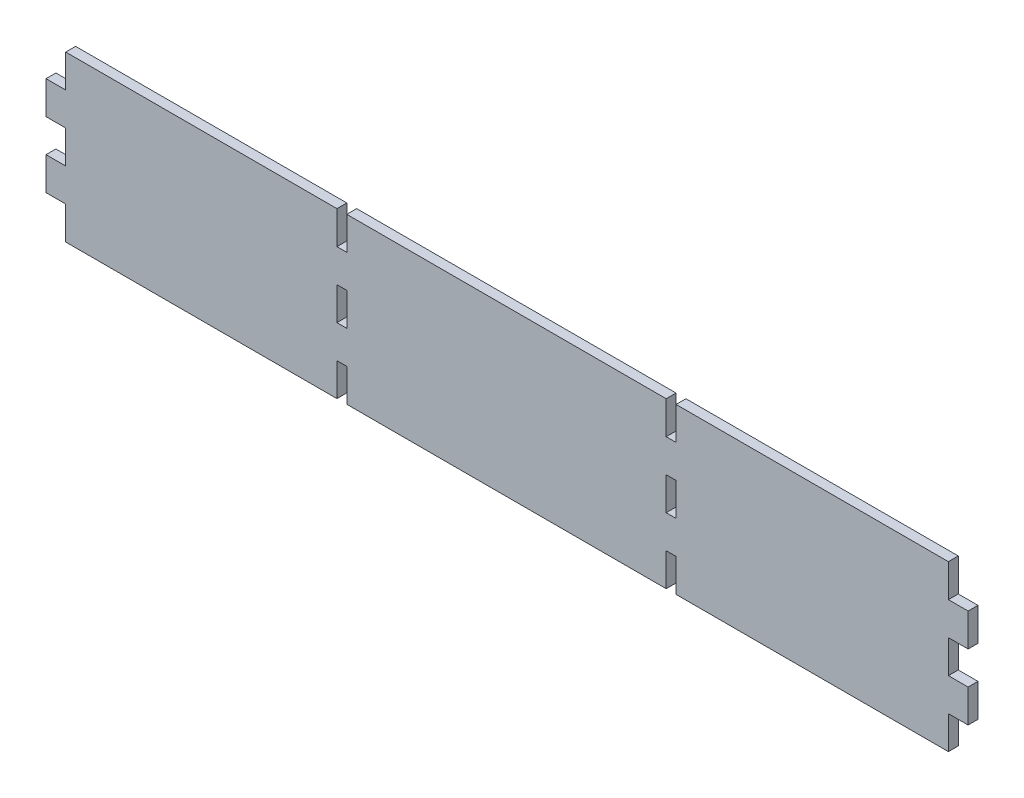
from build123d import *

# Parameters (mm, degrees)
SKETCH1_W           = 3
SKETCH1_H           = 10
BOSS_EXTRUDE1_DEPTH = 3


with BuildPart() as part:
    # Sketch1 → Boss-Extrude1 (new body)
    with BuildSketch(Plane.XY):
        Polygon((-85.4, 23.2), (-91.4, 23.2), (-91.4, 13.2), (-85.4, 13.2), (-85.4, 3.2), (-3, 3.2), (-3, 13.2), (0, 13.2), (0, 3.2), (97.05, 3.2), (97.05, 13.2), (100.05, 13.2), (100.05, 3.2), (182.8, 3.2), (182.8, 13.2), (188.8, 13.2), (188.8, 23.2), (182.8, 23.2), (182.8, 33.2), (188.8, 33.2), (188.8, 43.2), (182.8, 43.2), (182.8, 53.2), (100.05, 53.2), (100.05, 43.2), (97.05, 43.2), (97.05, 53.2), (0, 53.2), (0, 43.2), (-3, 43.2), (-3, 53.2), (-85.4, 53.2), (-85.4, 43.2), (-91.4, 43.2), (-91.4, 33.2), (-85.4, 33.2), align=None)
        with Locations((98.55, 28.2)):
            Rectangle(SKETCH1_W, SKETCH1_H, mode=Mode.SUBTRACT)
        with Locations((-1.5, 28.2)):
            Rectangle(SKETCH1_W, SKETCH1_H, mode=Mode.SUBTRACT)
    extrude(amount=BOSS_EXTRUDE1_DEPTH)


solid = part.part
